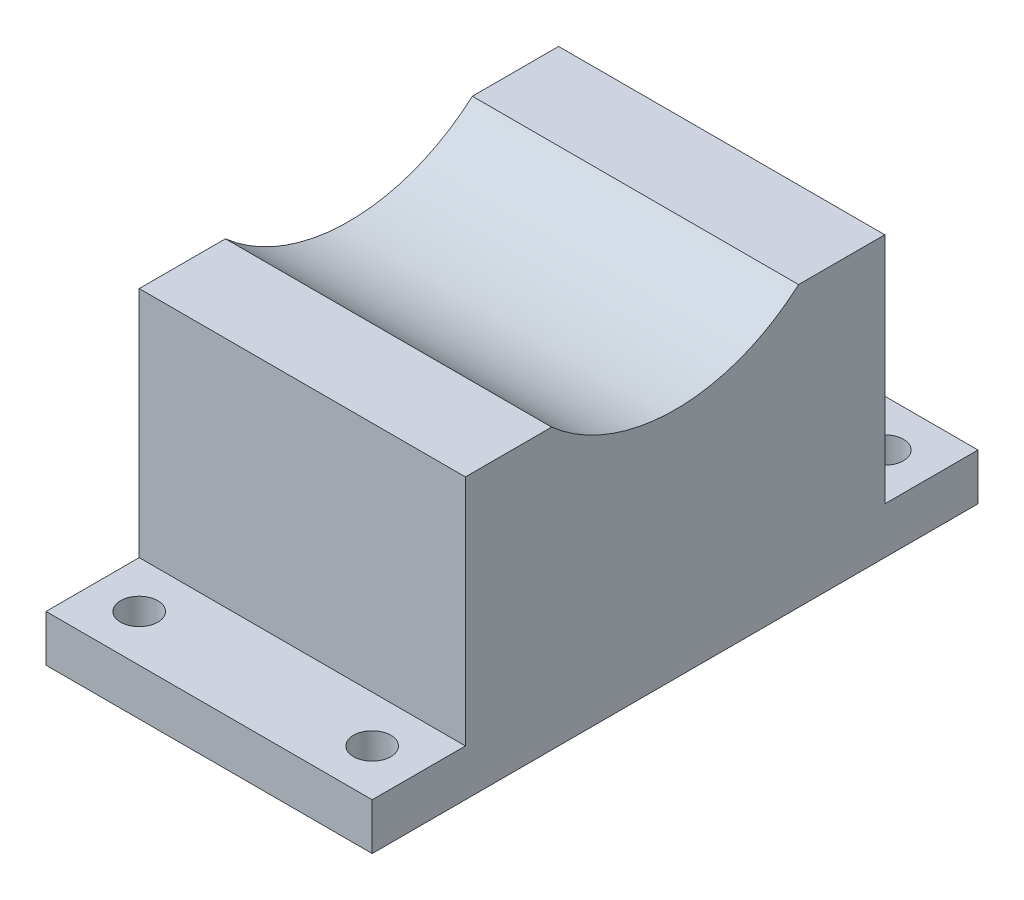
from build123d import *

# Parameters (mm, degrees)
EXTRUDE_1_DEPTH     = 35
SKETCH_5_R          = 2
CUT_EXTRUDE_2_DEPTH = 10


with BuildPart() as part:
    # 草图3 → 凸台-拉伸1 (new body)
    with BuildSketch(Plane(origin=(0, 0, 0), x_dir=(0, 0, -1), z_dir=(1, 0, 0))):
        with BuildLine():
            Line((37.055330611, 5.099345853), (46.308021103, 5.099345853))
            Line((46.308021103, 5.099345853), (46.308021103, -19.900654147))
            Line((46.308021103, -19.900654147), (56.308021103, -19.900654147))
            Line((56.308021103, -19.900654147), (56.308021103, -24.900654147))
            Line((56.308021103, -24.900654147), (-8.691978897, -24.900654147))
            Line((-8.691978897, -24.900654147), (-8.691978897, -19.900654147))
            Line((-8.691978897, -19.900654147), (1.308021103, -19.900654147))
            Line((1.308021103, -19.900654147), (1.308021103, 5.099345853))
            Line((1.308021103, 5.099345853), (10.560711596, 5.099345853))
            ThreePointArc((10.560711596, 5.099345853), (23.808021103, 0.087069391), (37.055330611, 5.099345853))
        make_face()
    extrude(amount=EXTRUDE_1_DEPTH)

    # 草图5 → 切除-拉伸2 (cut)
    with BuildSketch(Plane(origin=(0, -24.900654147, 0), x_dir=(-1, 0, 0), z_dir=(0, -1, 0))):
        with Locations(Location((-30, -3.691978897, 0), (0, 0, 90))):
            Circle(SKETCH_5_R)
        with Locations(Location((-5, -3.691978897, 0), (0, 0, 90))):
            Circle(SKETCH_5_R)
        with Locations(Location((-30, 51.308021103, 0), (0, 0, 90))):
            Circle(SKETCH_5_R)
        with Locations(Location((-5, 51.308021103, 0), (0, 0, 90))):
            Circle(SKETCH_5_R)
    extrude(amount=-CUT_EXTRUDE_2_DEPTH, mode=Mode.SUBTRACT)


solid = part.part
